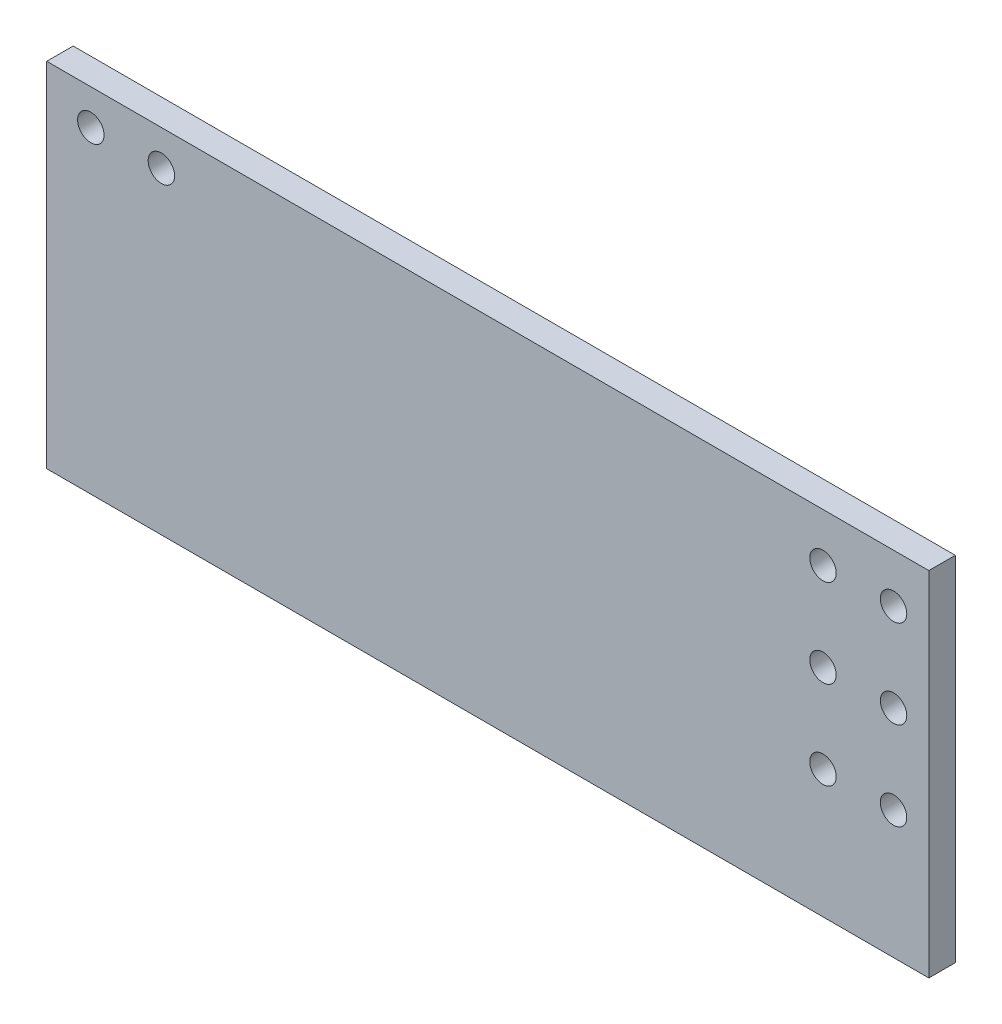
from build123d import *

# Parameters (mm, degrees)
SKETCH1_W           = 100
SKETCH1_H           = 55
SKETCH1_R           = 1.5
BOSS_EXTRUDE1_DEPTH = 3
SKETCH2_W           = 100
SKETCH2_H           = 12
CUT_EXTRUDE1_DEPTH  = 58.142366069
SKETCH3_W           = 100
SKETCH3_H           = 3
CUT_EXTRUDE2_DEPTH  = 58.142366069
SKETCH4_R           = 1.5
CUT_EXTRUDE3_DEPTH  = 56.760649207


with BuildPart() as part:
    # Sketch1 → Boss-Extrude1 (new body)
    with BuildSketch(Plane.XY):
        Rectangle(SKETCH1_W, SKETCH1_H)
        with Locations((38, 10)):
            Circle(SKETCH1_R, mode=Mode.SUBTRACT)
        with Locations((46, 10)):
            Circle(SKETCH1_R, mode=Mode.SUBTRACT)
        with Locations(Location((46, -10, 0), (0, 0, 180))):
            Circle(SKETCH1_R, mode=Mode.SUBTRACT)
        with Locations(Location((38, -10, 0), (0, 0, 180))):
            Circle(SKETCH1_R, mode=Mode.SUBTRACT)
        with Locations((38, 0)):
            Circle(SKETCH1_R, mode=Mode.SUBTRACT)
        with Locations((46, 0)):
            Circle(SKETCH1_R, mode=Mode.SUBTRACT)
    extrude(amount=BOSS_EXTRUDE1_DEPTH)

    # Sketch2 → Cut-Extrude1 (cut, through all)
    with BuildSketch(Plane.XY.offset(3)):
        with Locations((0, 21.5)):
            Rectangle(SKETCH2_W, SKETCH2_H)
    extrude(amount=-CUT_EXTRUDE1_DEPTH, mode=Mode.SUBTRACT)

    # Sketch3 → Cut-Extrude2 (cut, through all)
    with BuildSketch(Plane.XY.offset(3)):
        with Locations((0, -26)):
            Rectangle(SKETCH3_W, SKETCH3_H)
    extrude(amount=-CUT_EXTRUDE2_DEPTH, mode=Mode.SUBTRACT)

    # Sketch4 → Cut-Extrude3 (cut, through all)
    with BuildSketch(Plane.XY.offset(3)):
        with Locations((-45, 11.5)):
            Circle(SKETCH4_R)
        with Locations((-37, 11.5)):
            Circle(SKETCH4_R)
    extrude(amount=-CUT_EXTRUDE3_DEPTH, mode=Mode.SUBTRACT)


solid = part.part
